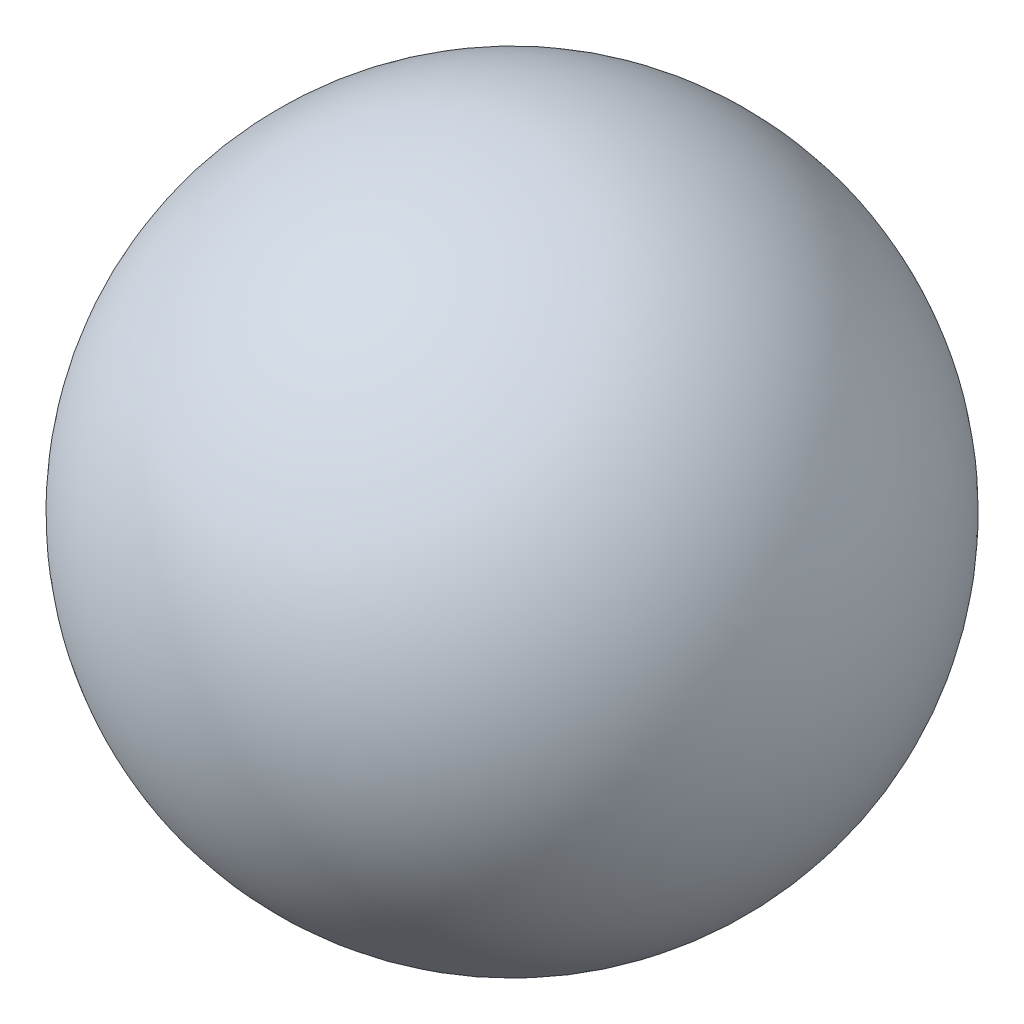
from build123d import *


with BuildPart() as part:
    # Sketch2 → Revolve1 (revolve)
    with BuildSketch(Plane(origin=(0, 0, 0), x_dir=(1, 0, 0), z_dir=(0, 1, 0))):
        with BuildLine():
            Line((0, 0), (0, 74))
            ThreePointArc((0, 74), (-37, 37), (0, 0))
        make_face()
    revolve(axis=Axis((0, 0, 0), (0, 0, -1)))


solid = part.part
